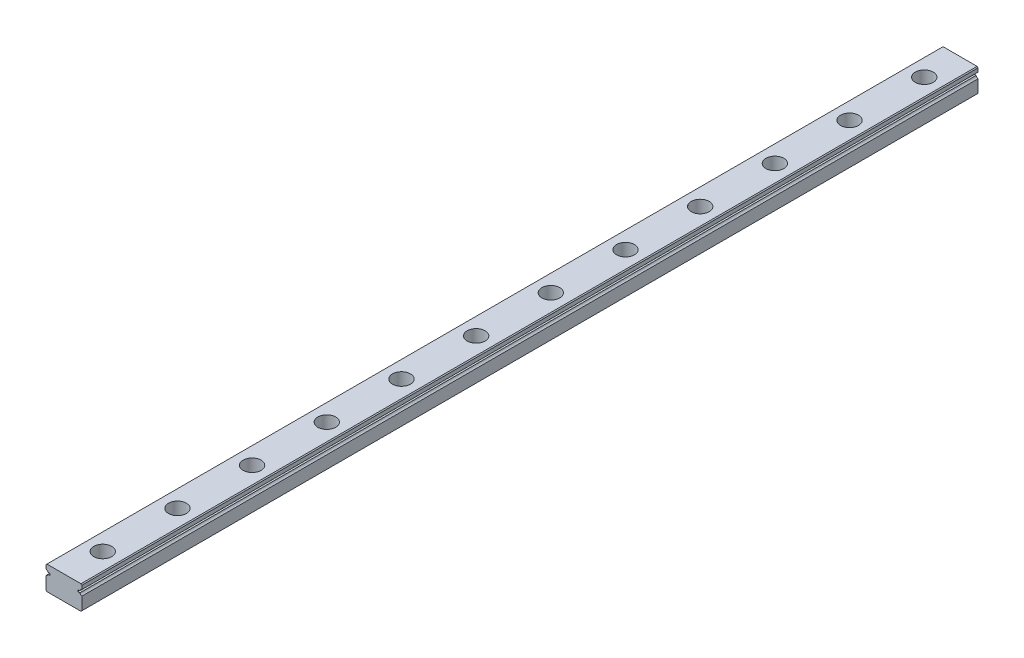
from build123d import *

# Parameters (mm, degrees)
EXTRUDE_1_DEPTH        = 300
SKETCH_2_R             = 3
SKETCH_2_R_2           = 1.75
CUT_EXTRUDE_1_DEPTH    = 4.5
SKETCH_2_2_R           = 1.75
CUT_EXTRUDE_2_DEPTH    = 301.166620396
PATTERN_LINEAR_1_COUNT = 16
PATTERN_LINEAR_1_PITCH = 25


with BuildPart() as part:
    # Эскиз1 → Бобышка-Вытянуть1 (new body)
    with BuildSketch(Plane.XY):
        with BuildLine():
            Line((-6, 3.7), (-5.7, 4))
            Line((-5.7, 4), (5.7, 4))
            Line((5.7, 4), (6, 3.7))
            Line((6, 3.7), (6, 2.451013544))
            ThreePointArc((6, 2.451013544), (5.597935912, 2.202976267), (5.354599002, 1.798050138))
            Line((5.354599002, 1.798050138), (4.643514056, 1.798050138))
            Line((4.643514056, 1.798050138), (4.643514056, 1.201949862))
            Line((4.643514056, 1.201949862), (5.354599002, 1.201949862))
            ThreePointArc((5.354599002, 1.201949862), (5.597935912, 0.797023733), (6, 0.548986456))
            Line((6, 0.548986456), (6, -3.7))
            Line((6, -3.7), (5.7, -4))
            Line((5.7, -4), (-5.7, -4))
            Line((-5.7, -4), (-6, -3.7))
            Line((-6, -3.7), (-6, 0.548986456))
            ThreePointArc((-6, 0.548986456), (-5.597935912, 0.797023733), (-5.354599002, 1.201949862))
            Line((-5.354599002, 1.201949862), (-4.643514056, 1.201949862))
            Line((-4.643514056, 1.201949862), (-4.643514056, 1.798050138))
            Line((-4.643514056, 1.798050138), (-5.354599002, 1.798050138))
            ThreePointArc((-5.354599002, 1.798050138), (-5.597935912, 2.202976267), (-6, 2.451013544))
            Line((-6, 2.451013544), (-6, 3.7))
        make_face()
    extrude(amount=EXTRUDE_1_DEPTH)

    # Эскиз2 → Вырез-Вытянуть1 (cut)
    with BuildSketch(Plane(origin=(0, 4, 0), x_dir=(1, 0, 0), z_dir=(0, 1, 0))):
        with Locations((0, -12)):
            Circle(SKETCH_2_R)
        with Locations((0, -12)):
            Circle(SKETCH_2_R_2, mode=Mode.SUBTRACT)
    cut_extrude_1 = extrude(amount=-CUT_EXTRUDE_1_DEPTH, mode=Mode.SUBTRACT)

    # Эскиз2<2> → Вырез-Вытянуть2 (cut, through all)
    with BuildSketch(Plane(origin=(0, 4, 0), x_dir=(1, 0, 0), z_dir=(0, 1, 0))):
        with Locations((0, -12)):
            Circle(SKETCH_2_2_R)
    cut_extrude_2 = extrude(amount=-CUT_EXTRUDE_2_DEPTH, mode=Mode.SUBTRACT)

    # Линейный массив1: Вырез-Вытянуть1, Вырез-Вытянуть2 ×16
    with Locations(*[(0, 0, i * PATTERN_LINEAR_1_PITCH) for i in range(1, PATTERN_LINEAR_1_COUNT)]):
        add(cut_extrude_1, mode=Mode.SUBTRACT)
        add(cut_extrude_2, mode=Mode.SUBTRACT)


solid = part.part
